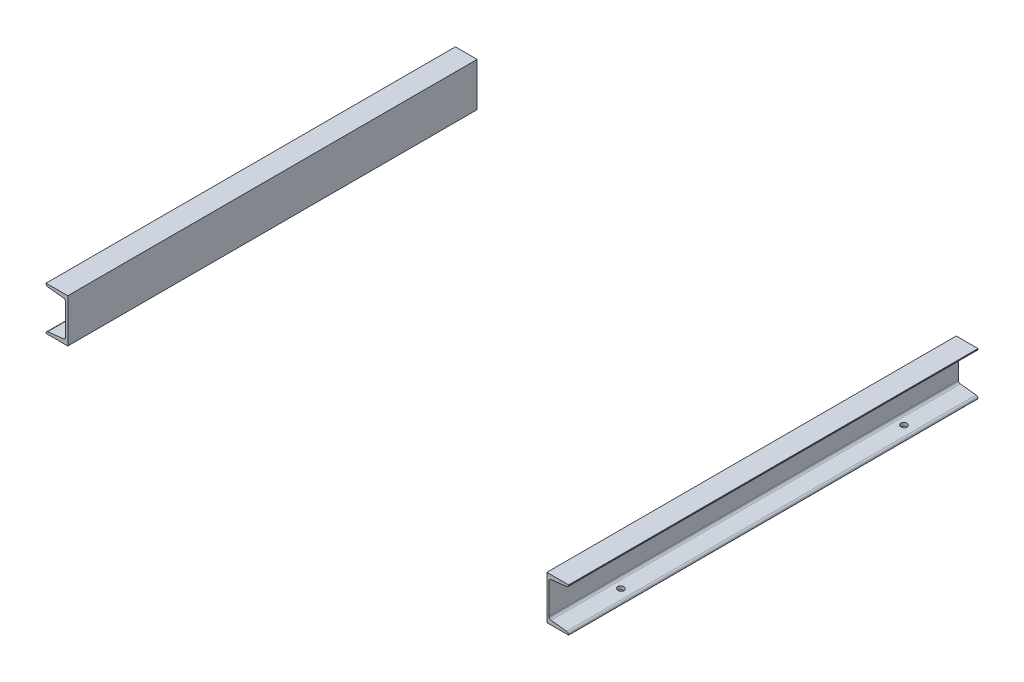
from build123d import *

# Parameters (mm, degrees)
BOSS_EXTRUDE1_DEPTH   = 470
BOSS_EXTRUDE1_2_DEPTH = 470
SKETCH2_R             = 7
CUT_EXTRUDE1_DEPTH    = 10


with BuildPart() as part:
    # Sketch1 → Boss-Extrude1 (new, symmetric)
    with BuildSketch(Plane.XY):
        with BuildLine():
            Line((-600, 0), (-550, 0))
            Line((-550, 0), (-550, -100))
            Line((-550, -100), (-600, -100))
            Line((-600, -100), (-600, -99.475213966))
            ThreePointArc((-600, -99.475213966), (-598.725640089, -96.140606654), (-595.55215763, -94.505795292))
            Line((-595.55215763, -94.505795292), (-559.44784237, -90.494204708))
            ThreePointArc((-559.44784237, -90.494204708), (-556.274359911, -88.859393346), (-555, -85.524786034))
            Line((-555, -85.524786034), (-555, -14.475213966))
            ThreePointArc((-555, -14.475213966), (-556.274359911, -11.140606654), (-559.44784237, -9.505795292))
            Line((-559.44784237, -9.505795292), (-595.55215763, -5.494204708))
            ThreePointArc((-595.55215763, -5.494204708), (-598.725640089, -3.859393346), (-600, -0.524786034))
            Line((-600, -0.524786034), (-600, 0))
        make_face()
    extrude(amount=BOSS_EXTRUDE1_DEPTH, both=True)


with BuildPart() as body_2:
    # Sketch1 → Boss-Extrude1 2 (new, symmetric)
    with BuildSketch(Plane.XY):
        with BuildLine():
            Line((600, 0), (550, 0))
            Line((550, 0), (550, -100))
            Line((550, -100), (600, -100))
            Line((600, -100), (600, -99.475213966))
            ThreePointArc((600, -99.475213966), (598.725640089, -96.140606654), (595.55215763, -94.505795292))
            Line((595.55215763, -94.505795292), (559.44784237, -90.494204708))
            ThreePointArc((559.44784237, -90.494204708), (556.274359911, -88.859393346), (555, -85.524786034))
            Line((555, -85.524786034), (555, -14.475213966))
            ThreePointArc((555, -14.475213966), (556.274359911, -11.140606654), (559.44784237, -9.505795292))
            Line((559.44784237, -9.505795292), (595.55215763, -5.494204708))
            ThreePointArc((595.55215763, -5.494204708), (598.725640089, -3.859393346), (600, -0.524786034))
            Line((600, -0.524786034), (600, 0))
        make_face()
    extrude(amount=BOSS_EXTRUDE1_2_DEPTH, both=True)


with BuildPart() as cut_extrude1_tool:
    # Sketch2 → Cut-Extrude1 (new body)
    with BuildSketch(Plane.XZ.offset(100)):
        with Locations(Location((-575, 325, 0), (0, 0, 270))):
            Circle(SKETCH2_R)
        with Locations(Location((-575, -325, 0), (0, 0, 180))):
            Circle(SKETCH2_R)
        with Locations(Location((575, -325, 0), (0, 0, 270))):
            Circle(SKETCH2_R)
        with Locations((575, 325)):
            Circle(SKETCH2_R)
    extrude(amount=-CUT_EXTRUDE1_DEPTH)


with BuildPart() as part_1:
    add(part.part)

    # Cut-Extrude1: cut by cut_extrude1_tool
    add(cut_extrude1_tool.part, mode=Mode.SUBTRACT)


with BuildPart() as body_2_1:
    add(body_2.part)

    # Cut-Extrude1: cut by cut_extrude1_tool
    add(cut_extrude1_tool.part, mode=Mode.SUBTRACT)


solid = Compound([part_1.part, body_2_1.part])
